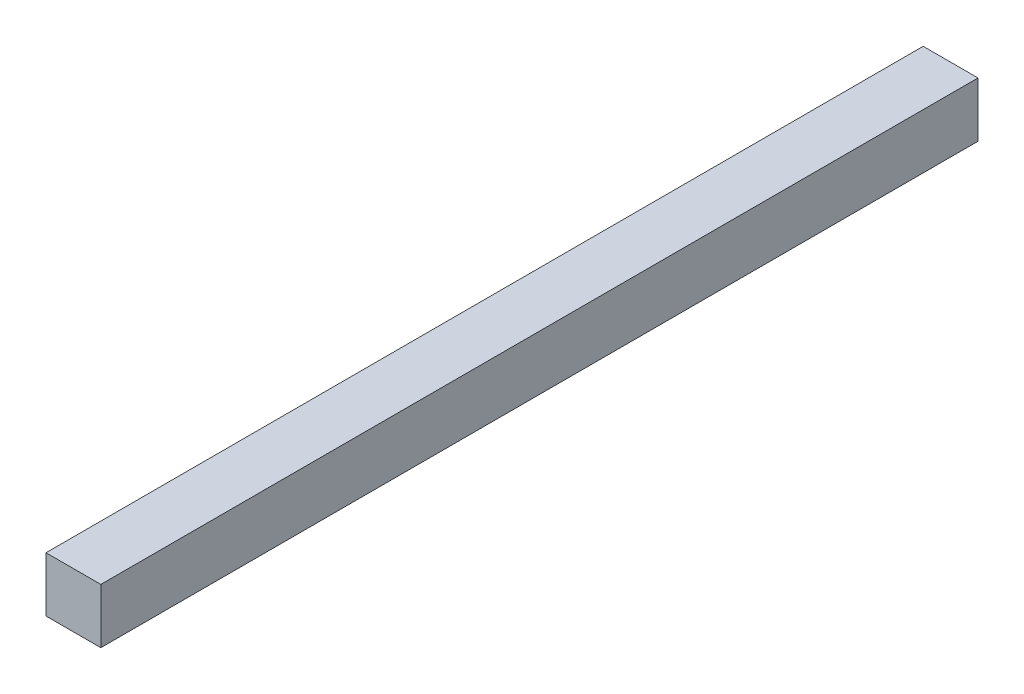
from build123d import *

# Parameters (mm, degrees)
SKETCH1_W           = 4.7625
SKETCH1_H           = 4.7625
BOSS_EXTRUDE1_DEPTH = 76.2


with BuildPart() as part:
    # Sketch1 → Boss-Extrude1 (new body)
    with BuildSketch(Plane.XY):
        Rectangle(SKETCH1_W, SKETCH1_H)
    extrude(amount=BOSS_EXTRUDE1_DEPTH)


solid = part.part
